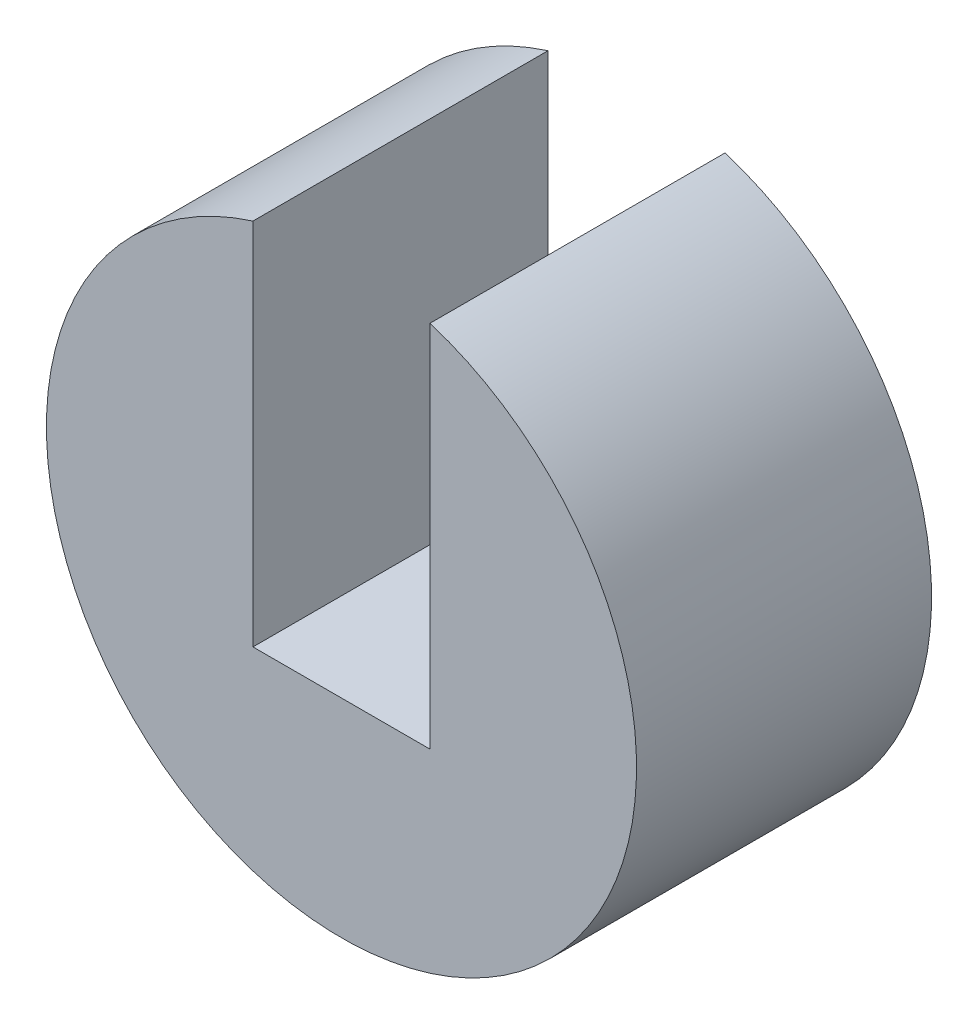
from build123d import *

# Parameters (mm, degrees)
BOSS_EXTRUDE1_DEPTH = 5


with BuildPart() as part:
    # Sketch1 → Boss-Extrude1 (new body)
    with BuildSketch(Plane.XY):
        with BuildLine():
            Line((1.5, 3.125), (1.5, -3.125))
            Line((1.5, -3.125), (-1.5, -3.125))
            Line((-1.5, -3.125), (-1.5, 3.125))
            ThreePointArc((-1.5, 3.125), (-2.958039892, -5.675824881), (5, -1.644696007))
            ThreePointArc((5, -1.644696007), (4.031128874, 1.313343884), (1.5, 3.125))
        make_face()
    extrude(amount=BOSS_EXTRUDE1_DEPTH)


solid = part.part
